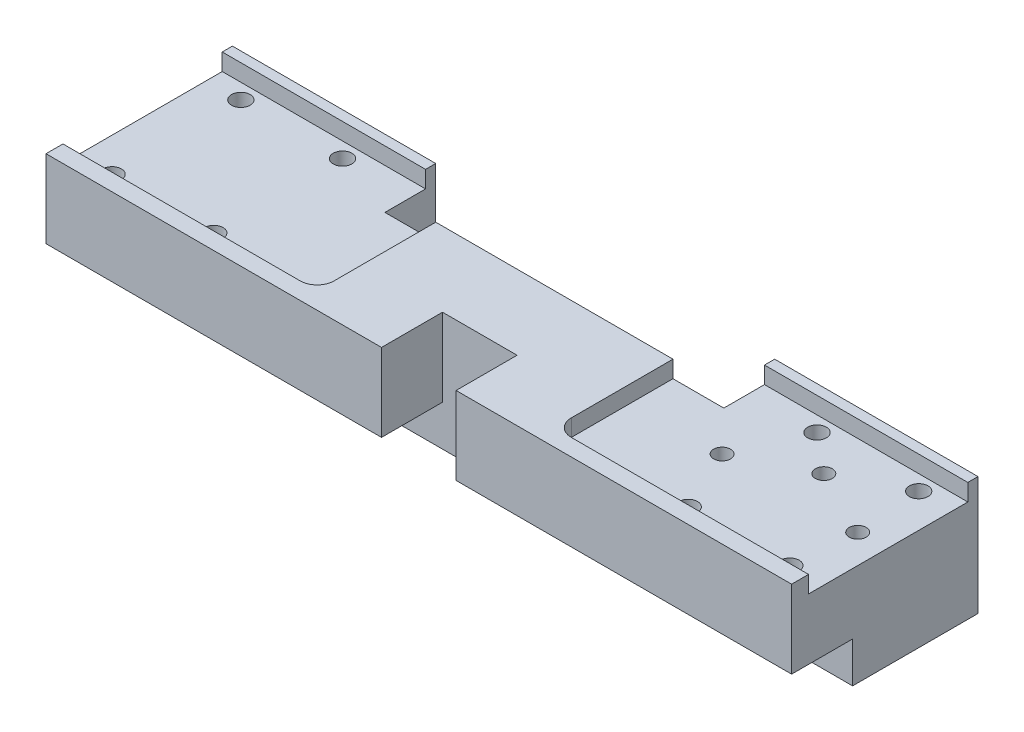
from build123d import *

# Parameters (mm, degrees)
SKETCH1_W                                           = 220
SKETCH1_H                                           = 55
BOSS_EXTRUDE1_DEPTH                                 = 17.5
SKETCH2_W                                           = 80
SKETCH2_H                                           = 47
CUT_EXTRUDE1_DEPTH                                  = 5
CBORE_FOR_M5_HEX_SOCKET_HEAD_CAP_SCREW1_D           = 5.5
CBORE_FOR_M5_HEX_SOCKET_HEAD_CAP_SCREW1_CBORE_D     = 10
CBORE_FOR_M5_HEX_SOCKET_HEAD_CAP_SCREW1_CBORE_DEPTH = 24
SKETCH10_W                                          = 18
SKETCH10_H                                          = 12
CUT_EXTRUDE4_DEPTH                                  = 223.401663663
SKETCH5_W                                           = 100
SKETCH5_H                                           = 80
CUT_EXTRUDE2_DEPTH                                  = 119.664442863
SKETCH6_W                                           = 22
SKETCH6_H                                           = 44.180340856
CUT_EXTRUDE3_DEPTH                                  = 119.664442863
FILLET1_R                                           = 5
M5_TAPPED_HOLE1_D                                   = 4.2
M5_TAPPED_HOLE1_DEPTH                               = 14
M5_TAPPED_HOLE1_TIP                                 = 1.2618073
M6_TAPPED_HOLE1_D                                   = 5
M6_TAPPED_HOLE1_DEPTH                               = 35
M6_TAPPED_HOLE1_TIP                                 = 1.502151548
F_6_0MM_DOWEL_HOLE1_D                               = 6
F_6_0MM_DOWEL_HOLE1_DEPTH                           = 20
F_6_0MM_DOWEL_HOLE1_TIP                             = 1.802581857


with BuildPart() as part:
    # Sketch1 → Boss-Extrude1 (new, symmetric)
    with BuildSketch(Plane(origin=(0, 0, 0), x_dir=(1, 0, 0), z_dir=(0, 1, 0))):
        Rectangle(SKETCH1_W, SKETCH1_H)
    extrude(amount=BOSS_EXTRUDE1_DEPTH, both=True)

    # Sketch2 → Cut-Extrude1 (cut)
    with BuildSketch(Plane(origin=(0, 17.5, 0), x_dir=(1, 0, 0), z_dir=(0, 1, 0))):
        with Locations((-75, 1)):
            Rectangle(SKETCH2_W, SKETCH2_H)
    cut_extrude1 = extrude(amount=-CUT_EXTRUDE1_DEPTH, mode=Mode.SUBTRACT)

    # Mirror1: Cut-Extrude1 across plane
    add(cut_extrude1.mirror(Plane(origin=(0, 0, 0), x_dir=(0, 0, 1), z_dir=(1, 0, 0))), mode=Mode.SUBTRACT)

    # CBORE for M5 Hex Socket Head Cap Screw1 (through all)
    with Locations(Plane(origin=(0, -17.5, 0), x_dir=(-1, 0, 0), z_dir=(0, -1, 0))):
        with Locations((-100, 20), (-70, 20), (-70, -18), (-100, -18), (70, 20), (100, 20), (100, -18), (70, -18)):
            CounterBoreHole(CBORE_FOR_M5_HEX_SOCKET_HEAD_CAP_SCREW1_D / 2, CBORE_FOR_M5_HEX_SOCKET_HEAD_CAP_SCREW1_CBORE_D / 2, CBORE_FOR_M5_HEX_SOCKET_HEAD_CAP_SCREW1_CBORE_DEPTH)

    # Sketch10 → Cut-Extrude4 (cut, through all)
    with BuildSketch(Plane.ZY.offset(110)):
        with Locations((18.5, -11.5)):
            Rectangle(SKETCH10_W, SKETCH10_H)
    extrude(amount=-CUT_EXTRUDE4_DEPTH, mode=Mode.SUBTRACT)

    # Sketch5 → Cut-Extrude2 (cut, through all)
    with BuildSketch(Plane.XZ.offset(17.5)):
        with Locations((0, -52.5)):
            Rectangle(SKETCH5_W, SKETCH5_H)
    extrude(amount=-CUT_EXTRUDE2_DEPTH, mode=Mode.SUBTRACT)

    # Sketch6 → Cut-Extrude3 (cut, through all)
    with BuildSketch(Plane.XZ.offset(17.5)):
        with Locations((0, 31.590170428)):
            Rectangle(SKETCH6_W, SKETCH6_H)
    extrude(amount=-CUT_EXTRUDE3_DEPTH, mode=Mode.SUBTRACT)

    # Fillet1
    fillet1_edges = [part.edges().sort_by_distance(p)[0] for p in [
        (-35, 15, 22.5),
        (35, 15, 22.5),
    ]]
    fillet(fillet1_edges, radius=FILLET1_R)

    # M5 Tapped Hole1
    with Locations(Plane(origin=(0, 0, -12.5), x_dir=(-1, 0, 0), z_dir=(0, 0, -1))):
        with Locations((-17, 12), (17, 12), (17, -12), (-17, -12)):
            Hole(M5_TAPPED_HOLE1_D / 2, depth=M5_TAPPED_HOLE1_DEPTH)
            with Locations((0, 0, -(M5_TAPPED_HOLE1_DEPTH + M5_TAPPED_HOLE1_TIP / 2))):  # 118° drill point
                Cone(0, M5_TAPPED_HOLE1_D / 2, M5_TAPPED_HOLE1_TIP, mode=Mode.SUBTRACT)

    # M6 Tapped Hole1
    with Locations(Plane(origin=(0, -17.5, 0), x_dir=(-1, 0, 0), z_dir=(0, -1, 0))):
        with Locations((-101.5, 0.5), (-81.5, 10.5), (-61.5, 0.5)):
            Hole(M6_TAPPED_HOLE1_D / 2, depth=M6_TAPPED_HOLE1_DEPTH)
            with Locations((0, 0, -(M6_TAPPED_HOLE1_DEPTH + M6_TAPPED_HOLE1_TIP / 2))):  # 118° drill point
                Cone(0, M6_TAPPED_HOLE1_D / 2, M6_TAPPED_HOLE1_TIP, mode=Mode.SUBTRACT)

    # Ø6.0mm Dowel Hole1
    with Locations(Plane(origin=(0, -17.5, 0), x_dir=(-1, 0, 0), z_dir=(0, -1, 0))):
        with Locations((-101.5, 10.5), (-61.5, 10.5)):
            Hole(F_6_0MM_DOWEL_HOLE1_D / 2, depth=F_6_0MM_DOWEL_HOLE1_DEPTH)
            with Locations((0, 0, -(F_6_0MM_DOWEL_HOLE1_DEPTH + F_6_0MM_DOWEL_HOLE1_TIP / 2))):  # 118° drill point
                Cone(0, F_6_0MM_DOWEL_HOLE1_D / 2, F_6_0MM_DOWEL_HOLE1_TIP, mode=Mode.SUBTRACT)


solid = part.part
